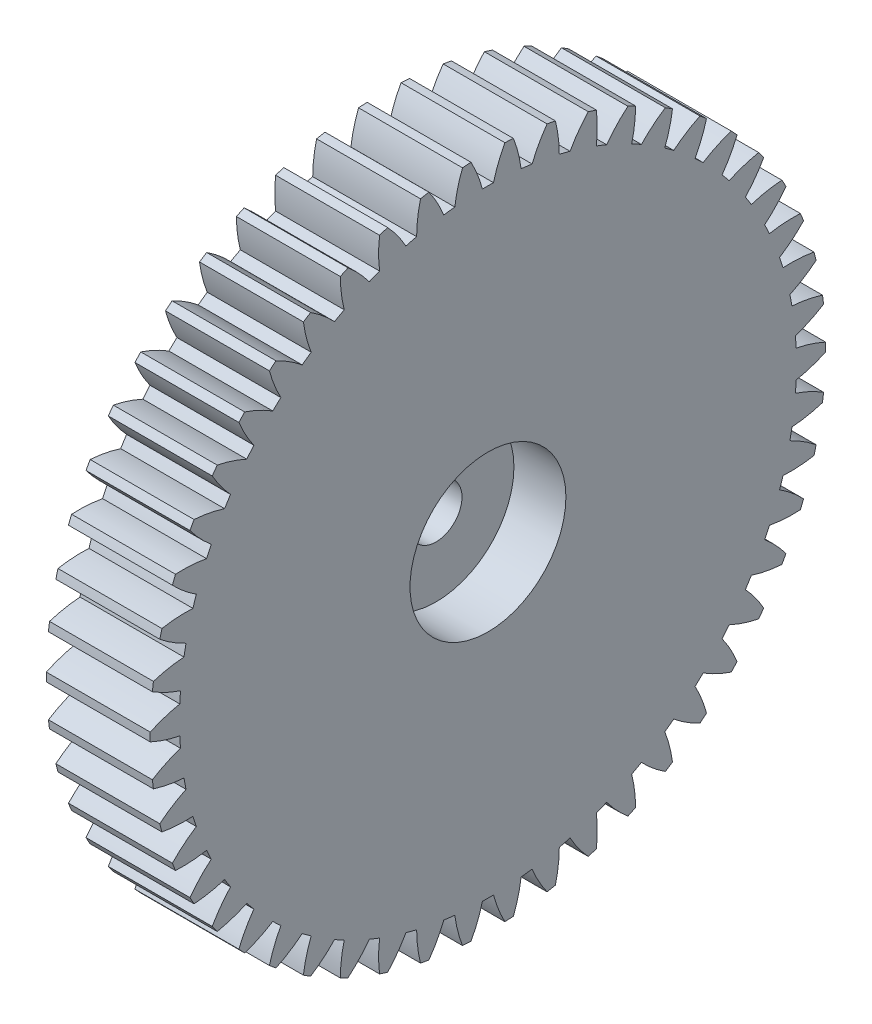
from build123d import *

# Parameters (mm, degrees)
BASPROSKE_W        = 2
BASPROSKE_H        = 6.5
TOOTHCUT_DEPTH     = 10.407443861
TEETHCUTS_COUNT    = 50
TEETHCUTS_ANGLE    = 352.8
BORSKE_R           = 0.5
BORE_DEPTH         = 50.0000508
SKETCH1_R          = 1.5
CUT_EXTRUDE1_DEPTH = 1


with BuildPart() as part:
    # BasProSke → Base-Revolve (revolve)
    with BuildSketch(Plane(origin=(0, 0, 0), x_dir=(1, 0, 0), z_dir=(0, 1, 0)), mode=Mode.PRIVATE) as base_revolve_sk:
        with Locations((1, 3.25)):
            Rectangle(BASPROSKE_W, BASPROSKE_H)
    revolve(base_revolve_sk.sketch.rotate(Axis((-10, 0, 0), (1, 0, 0)), 180), axis=Axis((-10, 0, 0), (1, 0, 0)))

    # TooCutSke → ToothCut (cut, through all)
    with BuildSketch(Plane(origin=(0, 0, 0), x_dir=(0, 0, -1), z_dir=(1, 0, 0))):
        with BuildLine():
            ThreePointArc((0.106726021, 5.935540566), (0, 5.9365), (-0.106726021, 5.935540566))
            ThreePointArc((-0.106726021, 5.935540566), (-0.20502053, 6.233368102), (-0.339830902, 6.516545106))
            ThreePointArc((-0.339830902, 6.516545106), (0, 6.5254), (0.339830902, 6.516545106))
            ThreePointArc((0.339830902, 6.516545106), (0.20502053, 6.233368102), (0.106726021, 5.935540566))
        make_face()
    toothcut = extrude(amount=TOOTHCUT_DEPTH, mode=Mode.SUBTRACT)

    # TeethCuts: ToothCut ×50 about axis
    teethcuts_axis = Axis((-10, 0, 0), (1, 0, 0))
    for i in range(1, TEETHCUTS_COUNT):
        add(toothcut.rotate(teethcuts_axis, i * TEETHCUTS_ANGLE / (TEETHCUTS_COUNT - 1)), mode=Mode.SUBTRACT)

    # BorSke → Bore (cut, symmetric)
    with BuildSketch(Plane(origin=(0, 0, 0), x_dir=(0, 0, -1), z_dir=(1, 0, 0))):
        with Locations(Location((0, 0, 0), (0, 0, 180))):
            Circle(BORSKE_R)
    extrude(amount=BORE_DEPTH, both=True, mode=Mode.SUBTRACT)

    # Sketch1 → Cut-Extrude1 (cut)
    with BuildSketch(Plane(origin=(2, 0, 0), x_dir=(0, 0, -1), z_dir=(1, 0, 0))):
        Circle(SKETCH1_R)
    extrude(amount=-CUT_EXTRUDE1_DEPTH, mode=Mode.SUBTRACT)


solid = part.part
